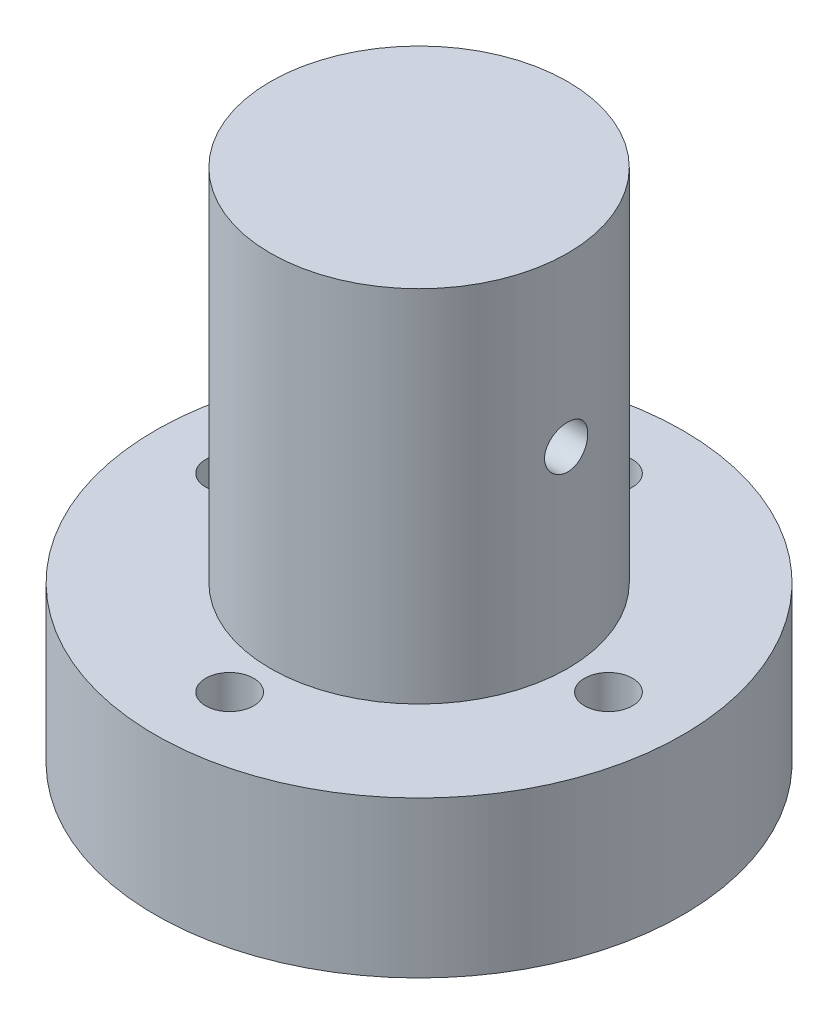
from build123d import *

# Parameters (mm, degrees)
SKETCH1_R               = 11
BOSS_EXTRUDE1_DEPTH     = 6.5
SKETCH2_R               = 1
CUT_EXTRUDE1_DEPTH      = 17.8597153
CIRPATTERN1_COUNT       = 4
SKETCH3_R               = 6.2
BOSS_EXTRUDE2_DEPTH     = 15
CUT_EXTRUDE2_DEPTH      = 27.537709019
CUT_EXTRUDE2_DEPTH_BACK = 27.537709019
SKETCH4_R               = 0.9


with BuildPart() as part:
    # Sketch1 → Boss-Extrude1 (new body)
    with BuildSketch(Plane(origin=(0, 0, 0), x_dir=(1, 0, 0), z_dir=(0, 1, 0))):
        Circle(SKETCH1_R)
    extrude(amount=BOSS_EXTRUDE1_DEPTH)

    # Sketch2 → Cut-Extrude1 (cut, through all)
    with BuildSketch(Plane(origin=(0, 6.5, 0), x_dir=(1, 0, 0), z_dir=(0, 1, 0))):
        with Locations((0, 7.9)):
            Circle(SKETCH2_R)
    cut_extrude1 = extrude(amount=-CUT_EXTRUDE1_DEPTH, mode=Mode.SUBTRACT)

    # CirPattern1: Cut-Extrude1 ×4 about axis
    cirpattern1_axis = Axis((0, 6.5, 0), (0, -1, 0))
    for i in range(1, CIRPATTERN1_COUNT):
        add(cut_extrude1.rotate(cirpattern1_axis, i * 360 / CIRPATTERN1_COUNT), mode=Mode.SUBTRACT)

    # Sketch3 → Boss-Extrude2 (add)
    with BuildSketch(Plane(origin=(0, 6.5, 0), x_dir=(1, 0, 0), z_dir=(0, 1, 0))):
        Circle(SKETCH3_R)
    extrude(amount=BOSS_EXTRUDE2_DEPTH)

    # Sketch4 → Cut-Extrude2 (cut, two sides: drawn at the far end of the back side and taken through both)
    with BuildSketch(Plane(origin=(0, 0, 0), x_dir=(0, 0, -1), z_dir=(1, 0, 0)).offset(-CUT_EXTRUDE2_DEPTH_BACK)):
        with Locations((0, 14.5)):
            Circle(SKETCH4_R)
    extrude(amount=CUT_EXTRUDE2_DEPTH + CUT_EXTRUDE2_DEPTH_BACK, mode=Mode.SUBTRACT)


solid = part.part
